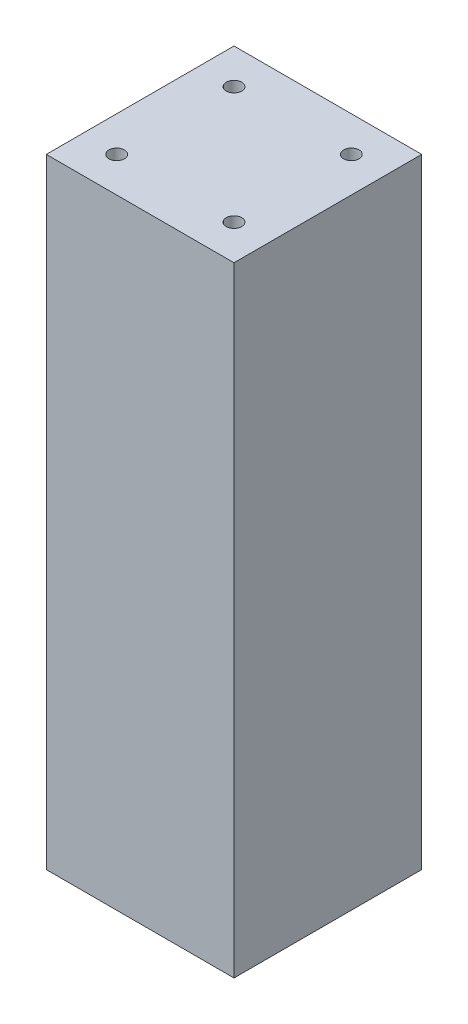
from build123d import *

# Parameters (mm, degrees)
SKIZZE1_W                       = 40
SKIZZE1_H                       = 40
AUFSATZ_LINEAR_AUSTRAGEN1_DEPTH = 66
M4_GEWINDEBOHRUNG1_D            = 3.3
M4_GEWINDEBOHRUNG1_DEPTH        = 11.5
M4_GEWINDEBOHRUNG1_TIP          = 0.991420021
M6_GEWINDEBOHRUNG1_D            = 5
M6_GEWINDEBOHRUNG1_DEPTH        = 17
M6_GEWINDEBOHRUNG1_CSINK_D      = 6.05
M6_GEWINDEBOHRUNG1_CSINK_ANGLE  = 90
M6_GEWINDEBOHRUNG1_TIP          = 1.502151548
F_6_0MM_STIFTLOCH1_D            = 6
F_6_0MM_STIFTLOCH1_DEPTH        = 17
F_6_0MM_STIFTLOCH1_TIP          = 1.802581857


with BuildPart() as part:
    # Skizze1 → Aufsatz-Linear austragen1 (new, symmetric)
    with BuildSketch(Plane(origin=(0, 0, 0), x_dir=(1, 0, 0), z_dir=(0, 1, 0))):
        Rectangle(SKIZZE1_W, SKIZZE1_H)
    extrude(amount=AUFSATZ_LINEAR_AUSTRAGEN1_DEPTH, both=True)

    # M4 Gewindebohrung1
    with Locations(Plane(origin=(0, 66, 0), x_dir=(1, 0, 0), z_dir=(0, 1, 0))):
        with Locations((-12.5, 12.5), (12.5, 12.5), (12.5, -12.5), (-12.5, -12.5)):
            Hole(M4_GEWINDEBOHRUNG1_D / 2, depth=M4_GEWINDEBOHRUNG1_DEPTH)
            with Locations((0, 0, -(M4_GEWINDEBOHRUNG1_DEPTH + M4_GEWINDEBOHRUNG1_TIP / 2))):  # 118° drill point
                Cone(0, M4_GEWINDEBOHRUNG1_D / 2, M4_GEWINDEBOHRUNG1_TIP, mode=Mode.SUBTRACT)

    # M6 Gewindebohrung1
    with Locations(Plane(origin=(0, -66, 0), x_dir=(-1, 0, 0), z_dir=(0, -1, 0))):
        with Locations((10, 12.5), (10, -12.5)):
            CounterSinkHole(M6_GEWINDEBOHRUNG1_D / 2, M6_GEWINDEBOHRUNG1_CSINK_D / 2, depth=M6_GEWINDEBOHRUNG1_DEPTH, counter_sink_angle=M6_GEWINDEBOHRUNG1_CSINK_ANGLE)
            with Locations((0, 0, -(M6_GEWINDEBOHRUNG1_DEPTH + M6_GEWINDEBOHRUNG1_TIP / 2))):  # 118° drill point
                Cone(0, M6_GEWINDEBOHRUNG1_D / 2, M6_GEWINDEBOHRUNG1_TIP, mode=Mode.SUBTRACT)

    # Ø6.0mm Stiftloch1
    with Locations(Plane(origin=(0, -66, 0), x_dir=(-1, 0, 0), z_dir=(0, -1, 0))):
        with Locations((10, 0), (-10, 0)):
            Hole(F_6_0MM_STIFTLOCH1_D / 2, depth=F_6_0MM_STIFTLOCH1_DEPTH)
            with Locations((0, 0, -(F_6_0MM_STIFTLOCH1_DEPTH + F_6_0MM_STIFTLOCH1_TIP / 2))):  # 118° drill point
                Cone(0, F_6_0MM_STIFTLOCH1_D / 2, F_6_0MM_STIFTLOCH1_TIP, mode=Mode.SUBTRACT)


solid = part.part
